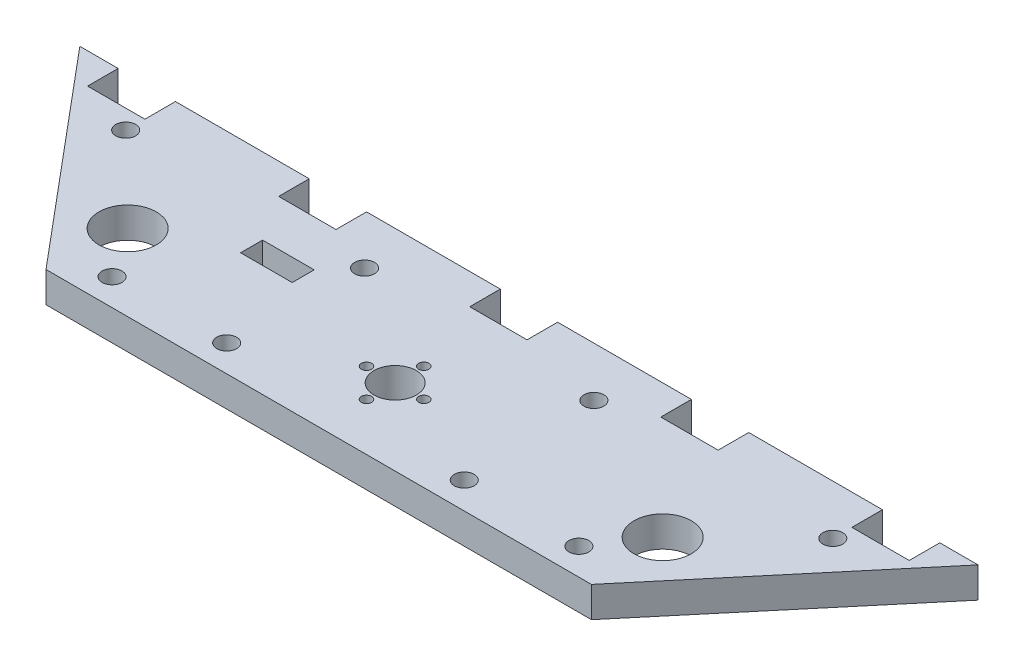
from build123d import *

# Parameters (mm, degrees)
IZIM1_R                              = 2.6821485
IZIM1_R_2                            = 2.780383132
IZIM1_R_3                            = 7.5
IZIM1_R_4                            = 5.187481638
IZIM1_W                              = 13.5
IZIM1_H                              = 5.75
IZIM1_R_5                            = 3.602615137
IZIM1_R_6                            = 4.041767392
Y_KSEKLIK_EKSTR_ZYON1_DEPTH          = 8
M5_HELISARMAL_I_IN_Z_VANA_MATKAB_2_D = 5.2
IZIM13_R                             = 5.55
IZIM13_R_2                           = 1.35
KES_EKSTR_ZYON5_DEPTH                = 10
IZIM14_W                             = 15
IZIM14_H                             = 8
KES_EKSTR_ZYON6_DEPTH                = 8


with BuildPart() as part:
    # Çizim1 → Yükseklik-Ekstrüzyon1 (new body)
    # profile 1 of 9: a face of its own
    with BuildSketch(Plane(origin=(0, 0, 0), x_dir=(1, 0, 0), z_dir=(0, 1, 0))):
        Polygon((-109.77435772, 54.233807267), (-63.623878006, -0.766192733), (7.740916272, -0.766192733), (79.105710549, -0.766192733), (125.256190264, 54.233807267), (7.740916272, 54.233807267), align=None)
        with Locations((-53.338342967, 6.233807267)):
            Circle(IZIM1_R, mode=Mode.SUBTRACT)
        with Locations((-23.338342967, 6.233807267)):
            Circle(IZIM1_R_2, mode=Mode.SUBTRACT)
        with Locations(Location((-62.259083728, 19.233807267, 0), (0, 0, 270))):
            Circle(IZIM1_R_3, mode=Mode.SUBTRACT)
        with Locations((38.820175511, 6.233807267)):
            Circle(IZIM1_R_2, mode=Mode.SUBTRACT)
        with Locations((68.820175511, 6.233807267)):
            Circle(IZIM1_R, mode=Mode.SUBTRACT)
        with Locations(Location((7.740916272, 19.233807267, 0), (0, 0, 270))):
            Circle(IZIM1_R_4, mode=Mode.SUBTRACT)
        with Locations(Location((77.740916272, 19.233807267, 0), (0, 0, 270))):
            Circle(IZIM1_R_3, mode=Mode.SUBTRACT)
        with Locations((-35.200733135, 31.358807267)):
            Rectangle(IZIM1_W, IZIM1_H, mode=Mode.SUBTRACT)
        with Locations((-84.77435772, 41.233807267)):
            Circle(IZIM1_R_5, mode=Mode.SUBTRACT)
        with Locations((-22.259083728, 41.233807267)):
            Circle(IZIM1_R_6, mode=Mode.SUBTRACT)
        with Locations((37.740916272, 41.233807267)):
            Circle(IZIM1_R_6, mode=Mode.SUBTRACT)
        with Locations((100.256190264, 41.233807267)):
            Circle(IZIM1_R_5, mode=Mode.SUBTRACT)
    # profile 2 of 9: a face of its own
    with BuildSketch(Plane(origin=(0, 0, 0), x_dir=(1, 0, 0), z_dir=(0, 1, 0))):
        with Locations((-84.77435772, 41.233807267)):
            Circle(IZIM1_R_5)
    # profile 3 of 9: a face of its own
    with BuildSketch(Plane(origin=(0, 0, 0), x_dir=(1, 0, 0), z_dir=(0, 1, 0))):
        with Locations((-22.259083728, 41.233807267)):
            Circle(IZIM1_R_6)
    # profile 4 of 9: a face of its own
    with BuildSketch(Plane(origin=(0, 0, 0), x_dir=(1, 0, 0), z_dir=(0, 1, 0))):
        with Locations((37.740916272, 41.233807267)):
            Circle(IZIM1_R_6)
    # profile 5 of 9: a face of its own
    with BuildSketch(Plane(origin=(0, 0, 0), x_dir=(1, 0, 0), z_dir=(0, 1, 0))):
        with Locations((100.256190264, 41.233807267)):
            Circle(IZIM1_R_5)
    # profile 6 of 9: a face of its own
    with BuildSketch(Plane(origin=(0, 0, 0), x_dir=(1, 0, 0), z_dir=(0, 1, 0))):
        with Locations((68.820175511, 6.233807267)):
            Circle(IZIM1_R)
    # profile 7 of 9: a face of its own
    with BuildSketch(Plane(origin=(0, 0, 0), x_dir=(1, 0, 0), z_dir=(0, 1, 0))):
        with Locations((38.820175511, 6.233807267)):
            Circle(IZIM1_R_2)
    # profile 8 of 9: a face of its own
    with BuildSketch(Plane(origin=(0, 0, 0), x_dir=(1, 0, 0), z_dir=(0, 1, 0))):
        with Locations((-53.338342967, 6.233807267)):
            Circle(IZIM1_R)
    # profile 9 of 9: a face of its own
    with BuildSketch(Plane(origin=(0, 0, 0), x_dir=(1, 0, 0), z_dir=(0, 1, 0))):
        with Locations((-23.338342967, 6.233807267)):
            Circle(IZIM1_R_2)
    extrude(amount=Y_KSEKLIK_EKSTR_ZYON1_DEPTH)

    # M5 Helisarmal için Zıvana matkabı2 (through all)
    with Locations(Plane(origin=(0, 0, 0), x_dir=(-1, 0, 0), z_dir=(0, -1, 0))):
        with Locations((-68.820175511, 6.233807267), (-38.820175511, 6.233807267), (-37.740916272, 41.233807267), (-100.256190264, 41.233807267), (22.259083728, 41.233807267), (23.338342967, 6.233807267), (53.338342967, 6.233807267), (84.77435772, 41.233807267)):
            Hole(M5_HELISARMAL_I_IN_Z_VANA_MATKAB_2_D / 2)

    # Çizim13 → Kes-Ekstrüzyon5 (cut)
    with BuildSketch(Plane.XZ):
        with Locations(Location((7.740916272, -19.233807267, 0), (0, 0, 270))):
            Circle(IZIM13_R)
        with Locations(Location((15.240916272, -19.233807267, 0), (0, 0, 270))):
            Circle(IZIM13_R_2)
        with Locations(Location((7.740916272, -26.733807267, 0), (0, 0, 270))):
            Circle(IZIM13_R_2)
        with Locations(Location((0.240916272, -19.233807267, 0), (0, 0, 270))):
            Circle(IZIM13_R_2)
        with Locations(Location((7.740916272, -11.733807267, 0), (0, 0, 270))):
            Circle(IZIM13_R_2)
    extrude(amount=-KES_EKSTR_ZYON5_DEPTH, mode=Mode.SUBTRACT)

    # Çizim14 → Kes-Ekstrüzyon6 (cut)
    with BuildSketch(Plane(origin=(0, 0, -54.233807267), x_dir=(-1, 0, 0), z_dir=(0, 0, -1))):
        with Locations((-107.756190264, 4)):
            Rectangle(IZIM14_W, IZIM14_H)
        with Locations((-57.756190264, 4)):
            Rectangle(IZIM14_W, IZIM14_H)
        with Locations((-7.756190264, 4)):
            Rectangle(IZIM14_W, IZIM14_H)
        with Locations((42.243809736, 4)):
            Rectangle(IZIM14_W, IZIM14_H)
        with Locations((92.243809736, 4)):
            Rectangle(IZIM14_W, IZIM14_H)
    extrude(amount=-KES_EKSTR_ZYON6_DEPTH, mode=Mode.SUBTRACT)


solid = part.part
